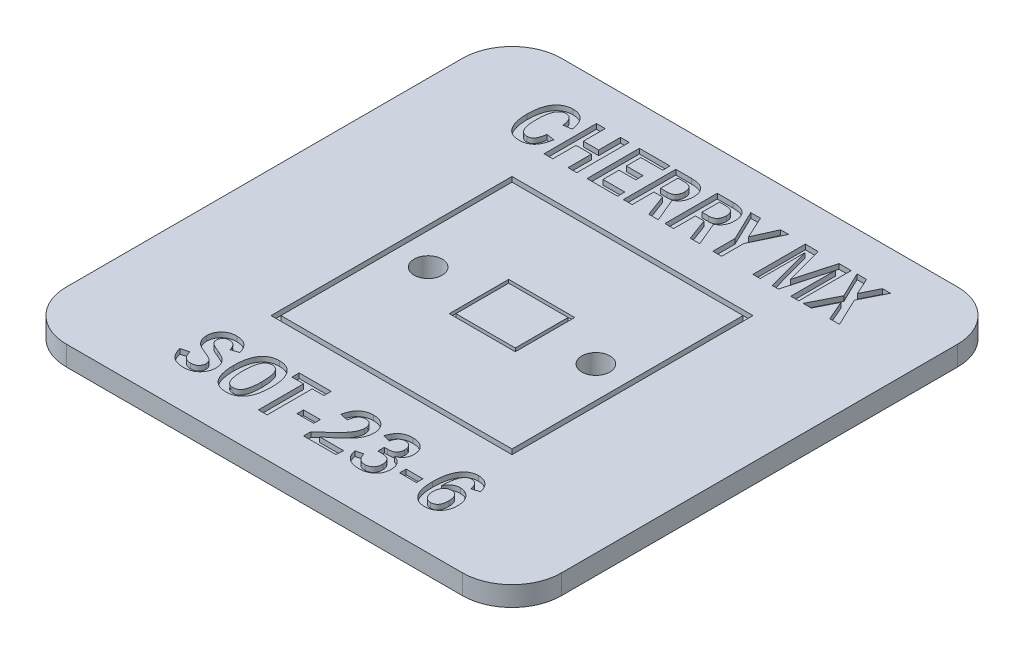
from build123d import *

# Parameters (mm, degrees)
SKETCH1_W               = 30
SKETCH1_H               = 30
BOSS_EXTRUDE1_DEPTH     = 1.2
SKETCH2_R               = 0.85
CUT_EXTRUDE1_DEPTH      = 22.247117452
SKETCH7_W               = 14.6
SKETCH7_H               = 14.6
SKETCH7_W_2             = 14
SKETCH7_H_2             = 14
CUT_EXTRUDE_THIN1_DEPTH = 0.3
SKETCH8_W               = 1.014236111
SKETCH8_H               = 0.396875
SKETCH8_W_2             = 1.014236112
CUT_EXTRUDE2_DEPTH      = 0.3
SKETCH9_W               = 4
SKETCH9_H               = 3.6
SKETCH9_W_2             = 3.6
SKETCH9_H_2             = 3.2
CUT_EXTRUDE_THIN2_DEPTH = 0.2
FILLET1_R               = 3


with BuildPart() as part:
    # Sketch1 → Boss-Extrude1 (new body)
    with BuildSketch(Plane(origin=(0, 0, 0), x_dir=(1, 0, 0), z_dir=(0, 1, 0))):
        Rectangle(SKETCH1_W, SKETCH1_H)
    extrude(amount=-BOSS_EXTRUDE1_DEPTH)

    # Sketch2 → Cut-Extrude1 (cut, through all)
    with BuildSketch(Plane(origin=(0, 0, 0), x_dir=(1, 0, 0), z_dir=(0, 1, 0))):
        with Locations(Location((-5.08, 0, 0), (0, 0, 270))):
            Circle(SKETCH2_R)
        with Locations(Location((5.08, 0, 0), (0, 0, 270))):
            Circle(SKETCH2_R)
    extrude(amount=-CUT_EXTRUDE1_DEPTH, mode=Mode.SUBTRACT)

    # Sketch7 → Cut-Extrude-Thin1 (cut)
    with BuildSketch(Plane(origin=(0, 0, 0), x_dir=(1, 0, 0), z_dir=(0, 1, 0))):
        Rectangle(SKETCH7_W, SKETCH7_H)
        Rectangle(SKETCH7_W_2, SKETCH7_H_2, mode=Mode.SUBTRACT)
    extrude(amount=-CUT_EXTRUDE_THIN1_DEPTH, mode=Mode.SUBTRACT)

    # Sketch8 → Cut-Extrude2 (cut)
    # profile 1 of 16: a face of its own
    with BuildSketch(Plane(origin=(0, 0, 0), x_dir=(1, 0, 0), z_dir=(0, 1, 0))):
        with BuildLine():
            Line((-6.305902778, -10.180242122), (-6.746875, -10.336649457))
            add(Edge.make_bspline(
                [(-6.746875, -10.336649457), (-6.759467834, -10.297802865), (-6.783348662, -10.224134874), (-6.828490901, -10.123364689), (-6.880369225, -10.039020337), (-6.937786584, -9.969131039), (-7.005455697, -9.915465301), (-7.083908539, -9.877650969), (-7.173574612, -9.855653747), (-7.236871996, -9.852975158), (-7.269840495, -9.851580012)],
                knots=[0, 0, 0, 0, 1.26087149, 2.391094449, 3.401030277, 4.312116731, 5.170791245, 6.046499601, 6.982517599, 8, 8, 8, 8], degree=3))
            add(Edge.make_bspline(
                [(-7.269840495, -9.851580012), (-7.300310709, -9.852921733), (-7.358462009, -9.855482359), (-7.440524245, -9.878012499), (-7.512070275, -9.915399533), (-7.569920187, -9.968832053), (-7.614785933, -10.030942091), (-7.648922552, -10.097645601), (-7.668796609, -10.169709002), (-7.67152773, -10.219168046), (-7.672916667, -10.244320898)],
                knots=[0, 0, 0, 0, 1.158393549, 2.210752077, 3.212357583, 4.203022126, 5.179064659, 6.11771898, 7.042748671, 8, 8, 8, 8], degree=3))
            add(Edge.make_bspline(
                [(-7.672916667, -10.244320898), (-7.671576988, -10.271364753), (-7.668982587, -10.323737463), (-7.645525759, -10.397928515), (-7.606483536, -10.463130205), (-7.561344713, -10.50967602), (-7.515957948, -10.543164177), (-7.474356275, -10.570371592), (-7.424864644, -10.598825275), (-7.36765403, -10.627815584), (-7.303777283, -10.659987902), (-7.231796355, -10.691984375), (-7.152591263, -10.725853187), (-7.096945705, -10.748111837), (-7.067957899, -10.759707182)],
                knots=[0, 0, 0, 0, 1.142383893, 2.212322889, 3.254295603, 4.333687511, 4.930565972, 5.639673117, 6.43668443, 7.345385944, 8.353993573, 9.463434283, 10.678610166, 12, 12, 12, 12], degree=3))
            add(Edge.make_bspline(
                [(-7.067957899, -10.759707182), (-7.019045569, -10.779174059), (-6.926587947, -10.815971755), (-6.799022166, -10.87589415), (-6.688127707, -10.932235043), (-6.593270116, -10.989706021), (-6.510703778, -11.05080341), (-6.438059801, -11.120394182), (-6.374907975, -11.200482197), (-6.318783212, -11.288448028), (-6.272994871, -11.384932494), (-6.240523884, -11.48973176), (-6.220916988, -11.601868222), (-6.218794349, -11.679237141), (-6.217708333, -11.718821766)],
                knots=[0, 0, 0, 0, 1.37004768, 2.589763122, 3.667395023, 4.60663127, 5.473533797, 6.336116821, 7.216601962, 8.122222573, 9.047579795, 9.987367701, 10.970267445, 12, 12, 12, 12], degree=3))
            add(Edge.make_bspline(
                [(-6.217708333, -11.718821766), (-6.218436446, -11.751248139), (-6.21987303, -11.815226208), (-6.233271394, -11.90945239), (-6.255615308, -11.999684218), (-6.284876267, -12.086940577), (-6.324873361, -12.169630733), (-6.372232435, -12.249422746), (-6.429488982, -12.32460231), (-6.493788242, -12.39606777), (-6.565781644, -12.461955239), (-6.646374713, -12.518188665), (-6.732912448, -12.566991634), (-6.826775592, -12.606454359), (-6.927849643, -12.636414601), (-7.03548258, -12.658400204), (-7.150073078, -12.671767592), (-7.22869193, -12.673110919), (-7.269151476, -12.673802234)],
                knots=[0, 0, 0, 0, 0.974796587, 1.923298778, 2.854746941, 3.7678046, 4.68542295, 5.611760636, 6.553903743, 7.522193674, 8.500239551, 9.481451027, 10.47101442, 11.483196193, 12.536447957, 13.636407375, 14.783626568, 16, 16, 16, 16], degree=3))
            add(Edge.make_bspline(
                [(-7.269151476, -12.673802234), (-7.304088828, -12.673172085), (-7.37251432, -12.671937925), (-7.472700257, -12.6613515), (-7.567908886, -12.644414819), (-7.658035104, -12.620177369), (-7.743023104, -12.589339216), (-7.822780635, -12.551121939), (-7.897506577, -12.506402064), (-7.966778772, -12.454200536), (-8.031164915, -12.395590047), (-8.089886856, -12.329514153), (-8.143975884, -12.256745001), (-8.1926529, -12.176850536), (-8.236124005, -12.090087592), (-8.274776048, -11.996906445), (-8.307870525, -11.896641529), (-8.325398479, -11.826890227), (-8.334375, -11.791168771)],
                knots=[0, 0, 0, 0, 1.105195373, 2.1645469, 3.183728959, 4.162091096, 5.113885907, 6.040261944, 6.956290289, 7.864676729, 8.780272584, 9.706648621, 10.657194193, 11.645545357, 12.662782435, 13.724897135, 14.834860619, 16, 16, 16, 16], degree=3))
            Line((-8.334375, -11.791168771), (-7.849305556, -11.659566123))
            add(Edge.make_bspline(
                [(-7.849305556, -11.659566123), (-7.844361034, -11.682847682), (-7.834734723, -11.728173713), (-7.815011567, -11.793137064), (-7.793218217, -11.853751783), (-7.768437484, -11.910116794), (-7.740121585, -11.961480231), (-7.709731006, -12.009022909), (-7.676090543, -12.052016779), (-7.638475777, -12.089607118), (-7.599274618, -12.124174707), (-7.556072038, -12.152822619), (-7.510483836, -12.17820278), (-7.461412654, -12.197626148), (-7.409977659, -12.214077201), (-7.355157313, -12.22462403), (-7.297596865, -12.23187972), (-7.258151034, -12.232510238), (-7.238145616, -12.232830012)],
                knots=[0, 0, 0, 0, 1.238522259, 2.411234589, 3.530812253, 4.590632793, 5.612616069, 6.581018509, 7.525884411, 8.447465876, 9.346193683, 10.241574854, 11.140461714, 12.057455654, 12.983987734, 13.947728852, 14.959166515, 16, 16, 16, 16], degree=3))
            add(Edge.make_bspline(
                [(-7.238145616, -12.232830012), (-7.218599566, -12.232494116), (-7.180781057, -12.231844211), (-7.125820964, -12.225088464), (-7.074143663, -12.216243391), (-7.026542975, -12.201400093), (-6.982399057, -12.183372298), (-6.941715455, -12.161561902), (-6.904771101, -12.13502596), (-6.861282218, -12.094781424), (-6.815055798, -12.038052456), (-6.775240031, -11.960879396), (-6.750632083, -11.876027913), (-6.748152219, -11.81683309), (-6.746875, -11.786345637)],
                knots=[0, 0, 0, 0, 0.938995443, 1.816807371, 2.659119456, 3.455387719, 4.207819431, 4.94882527, 5.668807742, 6.387688999, 7.792911655, 9.160685439, 10.537651384, 12, 12, 12, 12], degree=3))
            add(Edge.make_bspline(
                [(-6.746875, -11.786345637), (-6.747939533, -11.763514733), (-6.750064653, -11.717937553), (-6.767127305, -11.651185172), (-6.795646719, -11.587613749), (-6.827245447, -11.536231505), (-6.862254624, -11.496805116), (-6.896765864, -11.466215125), (-6.939260757, -11.434806219), (-6.990741759, -11.404661742), (-7.049216568, -11.371581989), (-7.116897469, -11.34002709), (-7.192111251, -11.306615191), (-7.245412994, -11.285464557), (-7.27328559, -11.274404448)],
                knots=[0, 0, 0, 0, 1.041379233, 2.078898261, 3.121121657, 4.214762738, 4.816429796, 5.521722936, 6.316496071, 7.224567373, 8.242943721, 9.382512311, 10.631260979, 12, 12, 12, 12], degree=3))
            add(Edge.make_bspline(
                [(-7.27328559, -11.274404448), (-7.303179337, -11.262782443), (-7.360820303, -11.240372955), (-7.443679766, -11.206456971), (-7.520181017, -11.174105063), (-7.590345778, -11.143324303), (-7.65392864, -11.113578747), (-7.711168494, -11.085392899), (-7.762056386, -11.058714286), (-7.821442028, -11.024891267), (-7.888406552, -10.976996124), (-7.962312908, -10.909718279), (-8.029017748, -10.829577419), (-8.089287554, -10.739430316), (-8.140115275, -10.639990713), (-8.175573338, -10.531910102), (-8.198713765, -10.417560366), (-8.200946638, -10.338831947), (-8.202083333, -10.298753406)],
                knots=[0, 0, 0, 0, 1.057021987, 2.038144284, 2.950550819, 3.794417178, 4.563101616, 5.263824, 5.896981152, 6.456546308, 7.515084904, 8.602669439, 9.741440011, 10.942265597, 12.171058942, 13.408563865, 14.680768927, 16, 16, 16, 16], degree=3))
            add(Edge.make_bspline(
                [(-8.202083333, -10.298753406), (-8.201263933, -10.267939651), (-8.199655739, -10.20746312), (-8.187721078, -10.118598449), (-8.167951301, -10.033559663), (-8.139262548, -9.952471832), (-8.103393191, -9.874752486), (-8.059164249, -9.800752894), (-8.006395555, -9.731085668), (-7.946574207, -9.66562667), (-7.880103721, -9.606086172), (-7.80818255, -9.55315632), (-7.730486307, -9.508801266), (-7.647329757, -9.473188583), (-7.559319867, -9.444559738), (-7.465792763, -9.424796305), (-7.367063859, -9.413045737), (-7.299500927, -9.411431621), (-7.265017361, -9.41060779)],
                knots=[0, 0, 0, 0, 1.021228651, 2.004311557, 2.966445923, 3.910333354, 4.85046725, 5.799712937, 6.762058142, 7.742809261, 8.734843209, 9.715535223, 10.697644764, 11.693353032, 12.70940338, 13.760670458, 14.857064595, 16, 16, 16, 16], degree=3))
            add(Edge.make_bspline(
                [(-7.265017361, -9.41060779), (-7.234447549, -9.41106167), (-7.174547744, -9.411951023), (-7.086788068, -9.421139105), (-7.00309976, -9.436077203), (-6.923703426, -9.45766938), (-6.848314694, -9.484215758), (-6.777471208, -9.517517939), (-6.711218396, -9.557319558), (-6.648150371, -9.601500201), (-6.590684917, -9.653551844), (-6.536725387, -9.710713349), (-6.487188549, -9.774177949), (-6.442199021, -9.843668504), (-6.401525671, -9.919053121), (-6.365100786, -10.000633882), (-6.33264151, -10.088108381), (-6.314936722, -10.14911383), (-6.305902778, -10.180242122)],
                knots=[0, 0, 0, 0, 1.094141776, 2.143908473, 3.155192916, 4.134582797, 5.086524694, 6.013491617, 6.931553119, 7.85112323, 8.765494759, 9.702076839, 10.662715678, 11.643450899, 12.662627666, 13.726311454, 14.839840677, 16, 16, 16, 16], degree=3))
        make_face()
    # profile 2 of 16: a face of its own
    with BuildSketch(Plane(origin=(0, 0, 0), x_dir=(1, 0, 0), z_dir=(0, 1, 0))):
        with BuildLine():
            add(Edge.make_bspline(
                [(-3.527777778, -11.040826974), (-3.528808867, -11.106069223), (-3.530807861, -11.232555736), (-3.543172435, -11.416282028), (-3.56719161, -11.587526521), (-3.597700782, -11.746982958), (-3.639770664, -11.893638968), (-3.688139556, -12.0289202), (-3.74906216, -12.150621986), (-3.816661208, -12.261101079), (-3.894554743, -12.358184149), (-3.980223672, -12.443059528), (-4.074709177, -12.514737507), (-4.177756023, -12.572906766), (-4.288762559, -12.618787318), (-4.408237435, -12.650920821), (-4.535842839, -12.670651272), (-4.623703762, -12.672733598), (-4.668793403, -12.673802234)],
                knots=[0, 0, 0, 0, 1.387405284, 2.689791638, 3.912290092, 5.062586086, 6.138607472, 7.153780875, 8.112601016, 9.027336013, 9.90293063, 10.752477972, 11.585654305, 12.41675262, 13.262021801, 14.132822719, 15.041777053, 16, 16, 16, 16], degree=3))
            add(Edge.make_bspline(
                [(-4.668793403, -12.673802234), (-4.714112059, -12.672742885), (-4.802201479, -12.670683746), (-4.930272511, -12.650897536), (-5.050010091, -12.618589701), (-5.162061535, -12.573798939), (-5.265680236, -12.515192738), (-5.361218404, -12.444030367), (-5.448052869, -12.359373042), (-5.527051211, -12.262522434), (-5.596264145, -12.152255029), (-5.657444888, -12.030144405), (-5.707910713, -11.895343549), (-5.749172036, -11.748222992), (-5.781149088, -11.588800048), (-5.804378488, -11.417139863), (-5.818107988, -11.233057738), (-5.819904983, -11.106307679), (-5.820833333, -11.040826974)],
                knots=[0, 0, 0, 0, 0.959958664, 1.865946784, 2.738602594, 3.583781031, 4.416404134, 5.254643166, 6.101502103, 6.980354043, 7.897287051, 8.855145282, 9.870419088, 10.942929064, 12.090431879, 13.313763798, 14.612255936, 16, 16, 16, 16], degree=3))
            add(Edge.make_bspline(
                [(-5.820833333, -11.040826974), (-5.819918078, -10.976032258), (-5.818140562, -10.850194529), (-5.804155182, -10.667560521), (-5.782092868, -10.496910741), (-5.749629285, -10.338528671), (-5.708657098, -10.192113139), (-5.658491499, -10.057440793), (-5.598579371, -9.935041679), (-5.529566341, -9.824642186), (-5.451541403, -9.726923988), (-5.364909299, -9.642002617), (-5.269428765, -9.570299598), (-5.165816161, -9.511385267), (-5.053456641, -9.466476725), (-4.933218621, -9.434246485), (-4.804781482, -9.413588488), (-4.71618714, -9.411616632), (-4.67086046, -9.41060779)],
                knots=[0, 0, 0, 0, 1.375616577, 2.671583047, 3.886798661, 5.026811174, 6.101251535, 7.112067152, 8.073852531, 8.989830394, 9.87099314, 10.722775264, 11.55862007, 12.3993867, 13.246086354, 14.120312836, 15.038313529, 16, 16, 16, 16], degree=3))
            add(Edge.make_bspline(
                [(-4.67086046, -9.41060779), (-4.626002291, -9.411678494), (-4.538601826, -9.413764624), (-4.411430323, -9.433495267), (-4.292420372, -9.465877807), (-4.180790448, -9.510455041), (-4.078622448, -9.569945976), (-3.98338746, -9.640502583), (-3.89801595, -9.725779317), (-3.819679295, -9.822482363), (-3.750705825, -9.932273389), (-3.690816688, -10.054295998), (-3.639776773, -10.188515703), (-3.598946517, -10.335315131), (-3.566519486, -10.494156841), (-3.54445861, -10.665496295), (-3.530453123, -10.849046296), (-3.528688076, -10.975572773), (-3.527777778, -11.040826974)],
                knots=[0, 0, 0, 0, 0.954287532, 1.859308474, 2.730970896, 3.575224249, 4.409568651, 5.240626948, 6.091014766, 6.970537783, 7.884636552, 8.844405276, 9.859441762, 10.93652768, 12.084136384, 13.307189876, 14.611222124, 16, 16, 16, 16], degree=3))
        make_face()
        with BuildLine():
            add(Edge.make_bspline(
                [(-4.101041667, -11.042205012), (-4.101399112, -10.997180642), (-4.1020943, -10.909613503), (-4.108593225, -10.782091167), (-4.117991747, -10.661871696), (-4.131230157, -10.549089774), (-4.150354869, -10.443705819), (-4.171946845, -10.345652707), (-4.197295376, -10.25455642), (-4.227196771, -10.171407334), (-4.262012418, -10.096467431), (-4.302691443, -10.030760485), (-4.349733838, -9.975161449), (-4.402808462, -9.929060743), (-4.462968778, -9.89460936), (-4.528725087, -9.869564769), (-4.600315647, -9.853967335), (-4.650108934, -9.852390104), (-4.675683594, -9.851580012)],
                knots=[0, 0, 0, 0, 1.466338751, 2.851857527, 4.157661103, 5.393542737, 6.548369209, 7.644528668, 8.662803672, 9.625923542, 10.519359159, 11.349553645, 12.134964639, 12.883046436, 13.627190835, 14.380156138, 15.16802127, 16, 16, 16, 16], degree=3))
            add(Edge.make_bspline(
                [(-4.675683594, -9.851580012), (-4.701260226, -9.852390408), (-4.751057354, -9.85396823), (-4.822410136, -9.869515594), (-4.888000632, -9.894424424), (-4.947113693, -9.930299809), (-5.000996721, -9.975507631), (-5.047886844, -10.031534966), (-5.088967094, -10.097123042), (-5.122572306, -10.172700612), (-5.152042695, -10.256235495), (-5.177108736, -10.347317661), (-5.19927603, -10.445209651), (-5.217099805, -10.550557985), (-5.230705006, -10.663234728), (-5.239966827, -10.783245224), (-5.246528411, -10.910300641), (-5.247215905, -10.99740976), (-5.247569444, -11.042205012)],
                knots=[0, 0, 0, 0, 0.832976012, 1.621785547, 2.368664186, 3.111060873, 3.865746753, 4.652099208, 5.483288837, 6.38142501, 7.34316566, 8.369870719, 9.460036704, 10.61496114, 11.852324209, 13.159693035, 14.539392097, 16, 16, 16, 16], degree=3))
            add(Edge.make_bspline(
                [(-5.247569444, -11.042205012), (-5.247130385, -11.086307655), (-5.246274784, -11.172251189), (-5.240863686, -11.297738924), (-5.231427986, -11.416365646), (-5.21742879, -11.528249369), (-5.200710125, -11.633438798), (-5.179295373, -11.731897471), (-5.153835971, -11.823165258), (-5.125572894, -11.907750024), (-5.091379287, -11.983830366), (-5.051169663, -12.050895313), (-5.002741084, -12.106790231), (-4.948446064, -12.152968205), (-4.887797098, -12.189384812), (-4.820433389, -12.215039863), (-4.746661364, -12.230439581), (-4.69528232, -12.232016842), (-4.668793403, -12.232830012)],
                knots=[0, 0, 0, 0, 1.431345973, 2.789287046, 4.07561803, 5.292336487, 6.447925522, 7.5313253, 8.560357691, 9.522128114, 10.422800425, 11.262726267, 12.050210629, 12.81183465, 13.567342581, 14.33423742, 15.141201474, 16, 16, 16, 16], degree=3))
            add(Edge.make_bspline(
                [(-4.668793403, -12.232830012), (-4.643920827, -12.231932039), (-4.595340066, -12.230178131), (-4.52519491, -12.215685469), (-4.460907773, -12.190697627), (-4.402755076, -12.155341969), (-4.349871141, -12.111031956), (-4.303473534, -12.056203203), (-4.262467313, -11.992024591), (-4.228051639, -11.917992025), (-4.197856572, -11.835589615), (-4.1719529, -11.74526411), (-4.149871991, -11.647026464), (-4.132501468, -11.540901813), (-4.117592537, -11.427211526), (-4.108708586, -11.305747262), (-4.102052619, -11.176637559), (-4.101385448, -11.087919805), (-4.101041667, -11.042205012)],
                knots=[0, 0, 0, 0, 0.812502347, 1.586968033, 2.328646143, 3.056091242, 3.802012743, 4.573963627, 5.394473157, 6.284347561, 7.236843263, 8.260856074, 9.353643111, 10.52614691, 11.774863089, 13.100342196, 14.505854215, 16, 16, 16, 16], degree=3))
        make_face(mode=Mode.SUBTRACT)
    # profile 3 of 16: a face of its own
    with BuildSketch(Plane(origin=(0, 0, 0), x_dir=(1, 0, 0), z_dir=(0, 1, 0))):
        Polygon((-3.439583333, -9.454705012), (-1.499305556, -9.454705012), (-1.499305556, -9.895677234), (-2.204861111, -9.895677234), (-2.204861111, -12.629705012), (-2.734027778, -12.629705012), (-2.734027778, -9.895677234), (-3.439583333, -9.895677234), align=None)
    # profile 4 of 16: a face of its own
    with BuildSketch(Plane(origin=(0, 0, 0), x_dir=(1, 0, 0), z_dir=(0, 1, 0))):
        with Locations((-0.859895834, -11.461128623)):
            Rectangle(SKETCH8_W, SKETCH8_H)
    # profile 5 of 16: a face of its own
    with BuildSketch(Plane(origin=(0, 0, 0), x_dir=(1, 0, 0), z_dir=(0, 1, 0))):
        with BuildLine():
            Line((0.485069444, -10.468941123), (0, -10.370411392))
            add(Edge.make_bspline(
                [(0, -10.370411392), (0.007603578, -10.332188397), (0.022404666, -10.257783696), (0.051340998, -10.150368278), (0.086298158, -10.050044447), (0.128003486, -9.95708327), (0.173662226, -9.870265958), (0.226524023, -9.791437789), (0.284535375, -9.719407664), (0.3479596, -9.654246428), (0.417094439, -9.597198058), (0.490506402, -9.547038239), (0.568668051, -9.505054253), (0.651217056, -9.470291322), (0.738488885, -9.44348383), (0.830240936, -9.424126079), (0.926698264, -9.413229396), (0.992390666, -9.411494206), (1.025949436, -9.41060779)],
                knots=[0, 0, 0, 0, 1.208990959, 2.353416033, 3.448797058, 4.501600363, 5.512293545, 6.488688184, 7.441389338, 8.378720737, 9.304851011, 10.218031639, 11.133156684, 12.053014379, 12.992969883, 13.961557313, 14.95866757, 16, 16, 16, 16], degree=3))
            add(Edge.make_bspline(
                [(1.025949436, -9.41060779), (1.062272623, -9.411371346), (1.13330223, -9.412864473), (1.23686239, -9.425389588), (1.334331721, -9.446131165), (1.426068848, -9.473996712), (1.511289141, -9.511457663), (1.590193814, -9.557457885), (1.664103738, -9.610442899), (1.730411051, -9.67273404), (1.790091154, -9.740620277), (1.842717071, -9.813441466), (1.885312009, -9.891795952), (1.923136568, -9.973401581), (1.949884021, -10.060725245), (1.970253081, -10.152127245), (1.981916959, -10.248384748), (1.983544115, -10.314111352), (1.984375, -10.347673762)],
                knots=[0, 0, 0, 0, 1.153049117, 2.254775329, 3.30603747, 4.314016098, 5.293632947, 6.254255045, 7.209686878, 8.174645019, 9.135765235, 10.076755048, 11.020228284, 11.963560592, 12.927608954, 13.91317933, 14.934392954, 16, 16, 16, 16], degree=3))
            add(Edge.make_bspline(
                [(1.984375, -10.347673762), (1.983044223, -10.387000669), (1.980378071, -10.465790381), (1.963049216, -10.583229271), (1.9327337, -10.69879737), (1.892199872, -10.813265322), (1.838555147, -10.925816313), (1.773316147, -11.036799931), (1.69736817, -11.147079932), (1.60826436, -11.254841026), (1.508889971, -11.363576987), (1.399133657, -11.473985648), (1.280014553, -11.588135039), (1.149653743, -11.70336265), (1.009219819, -11.821311812), (0.85926664, -11.942805632), (0.698107349, -12.065738748), (0.586285049, -12.147148841), (0.529166667, -12.18873279)],
                knots=[0, 0, 0, 0, 0.775754143, 1.554188977, 2.335426668, 3.12927755, 3.945964518, 4.790559411, 5.666455862, 6.584141519, 7.546209919, 8.57132063, 9.65437591, 10.799969579, 12.002421741, 13.271715478, 14.606403203, 16, 16, 16, 16], degree=3))
            Line((0.529166667, -12.18873279), (1.984375, -12.18873279))
            Line((1.984375, -12.18873279), (1.960948351, -12.629705012))
            Line((1.960948351, -12.629705012), (0, -12.629705012))
            Line((0, -12.629705012), (0, -12.192866904))
            add(Edge.make_bspline(
                [(0, -12.192866904), (0.038143845, -12.160274585), (0.112935431, -12.096368303), (0.222440628, -12.002178601), (0.326469747, -11.911208234), (0.425079251, -11.823783651), (0.518053648, -11.739420101), (0.606610126, -11.65920549), (0.688701023, -11.580927033), (0.76720758, -11.507884653), (0.838289457, -11.436306266), (0.90576397, -11.36986531), (0.966794054, -11.305490794), (1.023413811, -11.24516893), (1.07441673, -11.187964116), (1.120031433, -11.134299262), (1.160030317, -11.083813076), (1.206417641, -11.022345166), (1.256277116, -10.94773527), (1.309754782, -10.860805762), (1.35413757, -10.775263889), (1.39086892, -10.692290285), (1.419095373, -10.611332432), (1.440623038, -10.533019449), (1.452418576, -10.456441497), (1.454293008, -10.406045248), (1.455208333, -10.381435698)],
                knots=[0, 0, 0, 0, 1.516678391, 2.973868579, 4.366356088, 5.694219057, 6.957547615, 8.161561954, 9.305967908, 10.386437177, 11.402694521, 12.355117827, 13.248844122, 14.083961521, 14.856002481, 15.565406314, 16.212739872, 16.802889595, 17.892820286, 18.923980975, 19.886648798, 20.803800122, 21.664556433, 22.476286539, 23.255938589, 24, 24, 24, 24], degree=3))
            add(Edge.make_bspline(
                [(1.455208333, -10.381435698), (1.453869929, -10.344335663), (1.451290093, -10.272823652), (1.428288736, -10.170847925), (1.389869256, -10.079347082), (1.345414702, -10.01194254), (1.303241394, -9.965211278), (1.269236838, -9.934147098), (1.231896323, -9.908876354), (1.191940082, -9.887788516), (1.149393201, -9.871365809), (1.104104488, -9.859586576), (1.056260417, -9.852545758), (1.023447321, -9.85190691), (1.006656901, -9.851580012)],
                knots=[0, 0, 0, 0, 1.710231617, 3.296549565, 4.792499051, 6.268037961, 6.995902736, 7.693833713, 8.387568028, 9.070204489, 9.774782197, 10.486812605, 11.225703942, 12, 12, 12, 12], degree=3))
            add(Edge.make_bspline(
                [(1.006656901, -9.851580012), (0.988703616, -9.851804717), (0.953770766, -9.852241939), (0.902919415, -9.860661415), (0.854357787, -9.871681805), (0.809055734, -9.889291759), (0.766046514, -9.910767619), (0.726505016, -9.937710582), (0.689146235, -9.968995826), (0.655885086, -10.006078412), (0.623437626, -10.046569313), (0.5958207, -10.093137486), (0.569832276, -10.143827606), (0.547577261, -10.199566901), (0.527304721, -10.260006135), (0.510491385, -10.325232187), (0.495721502, -10.395322613), (0.48869862, -10.443859163), (0.485069444, -10.468941123)],
                knots=[0, 0, 0, 0, 0.960263485, 1.868445876, 2.754615096, 3.622841714, 4.464606068, 5.32442521, 6.179744268, 7.06770485, 7.988053711, 8.954365789, 9.961175504, 11.037158835, 12.165324358, 13.373801617, 14.642874175, 16, 16, 16, 16], degree=3))
        make_face()
    # profile 6 of 16: a face of its own
    with BuildSketch(Plane(origin=(0, 0, 0), x_dir=(1, 0, 0), z_dir=(0, 1, 0))):
        with BuildLine():
            Line((2.866319444, -10.292552234), (2.425347222, -10.18919937))
            add(Edge.make_bspline(
                [(2.425347222, -10.18919937), (2.43453625, -10.157584711), (2.452514471, -10.09573102), (2.486605505, -10.007472692), (2.524532235, -9.925409058), (2.565827362, -9.848826078), (2.612063547, -9.778637225), (2.662121148, -9.714157506), (2.717476957, -9.656735165), (2.775546457, -9.604045103), (2.838894046, -9.558138478), (2.906693708, -9.519319866), (2.977880854, -9.4846577), (3.054023419, -9.458575166), (3.133758514, -9.436577454), (3.218006431, -9.422085794), (3.306344204, -9.411702065), (3.366744457, -9.410977416), (3.397553168, -9.41060779)],
                knots=[0, 0, 0, 0, 1.164944352, 2.279199313, 3.344976403, 4.363635347, 5.35576875, 6.316941599, 7.248502688, 8.175476267, 9.08938109, 10.011063354, 10.938357728, 11.887176947, 12.855474768, 13.863305628, 14.910123768, 16, 16, 16, 16], degree=3))
            add(Edge.make_bspline(
                [(3.397553168, -9.41060779), (3.432715704, -9.411252425), (3.501133699, -9.412506732), (3.600756241, -9.422702103), (3.694464349, -9.440898223), (3.78252508, -9.465155615), (3.864725108, -9.497437455), (3.941583412, -9.535625908), (4.012157665, -9.582144082), (4.076391909, -9.635497175), (4.134293198, -9.694316627), (4.184282216, -9.759327501), (4.227304755, -9.828827608), (4.261745213, -9.903942764), (4.288778905, -9.983824581), (4.308136846, -10.068985304), (4.318895989, -10.159525345), (4.320637284, -10.221555893), (4.321527778, -10.253278146)],
                knots=[0, 0, 0, 0, 1.191820192, 2.319000844, 3.389360958, 4.42457143, 5.410600476, 6.378544248, 7.3286646, 8.268683313, 9.204630844, 10.120315031, 11.042989276, 11.969564078, 12.914983764, 13.897101508, 14.92458346, 16, 16, 16, 16], degree=3))
            add(Edge.make_bspline(
                [(4.321527778, -10.253278146), (4.320240525, -10.293141958), (4.31773862, -10.370621301), (4.29346908, -10.482107569), (4.255103109, -10.584714111), (4.200084537, -10.677753066), (4.130622905, -10.762294723), (4.044238136, -10.836092961), (3.943372711, -10.901867161), (3.86800186, -10.935739459), (3.828879123, -10.953321549)],
                knots=[0, 0, 0, 0, 1.044489364, 2.030070488, 2.977889712, 3.906906964, 4.85273231, 5.835029569, 6.876229085, 8, 8, 8, 8], degree=3))
            add(Edge.make_bspline(
                [(3.828879123, -10.953321549), (3.85242879, -10.960069071), (3.898705632, -10.973328453), (3.964342678, -10.999044873), (4.026015862, -11.027409549), (4.082924007, -11.059687641), (4.135834365, -11.095450863), (4.183141084, -11.135648831), (4.226622987, -11.178660718), (4.264989196, -11.225786901), (4.299907689, -11.275825644), (4.328603355, -11.330612546), (4.354399829, -11.387845746), (4.374226885, -11.449433728), (4.389980307, -11.514161605), (4.40174525, -11.582503896), (4.408762174, -11.654594436), (4.409396723, -11.703876979), (4.409722222, -11.729157052)],
                knots=[0, 0, 0, 0, 1.112507791, 2.186160371, 3.199276012, 4.194661506, 5.155645749, 6.096300007, 7.011308296, 7.930591238, 8.853952153, 9.77843283, 10.736295605, 11.703211035, 12.713096756, 13.76134447, 14.851654744, 16, 16, 16, 16], degree=3))
            add(Edge.make_bspline(
                [(4.409722222, -11.729157052), (4.408698595, -11.76478935), (4.406697094, -11.834461269), (4.393927051, -11.936163514), (4.370718084, -12.03176447), (4.340057141, -12.122190982), (4.299163635, -12.206549422), (4.24920524, -12.284731179), (4.190800382, -12.357366501), (4.123254683, -12.422902771), (4.049192545, -12.482050525), (3.969342071, -12.533127468), (3.884942831, -12.577159757), (3.794555826, -12.611829891), (3.699649432, -12.640693674), (3.599095738, -12.659294978), (3.493856152, -12.671460537), (3.421934604, -12.673009849), (3.385150825, -12.673802234)],
                knots=[0, 0, 0, 0, 1.088980448, 2.12928616, 3.125150545, 4.090676379, 5.041809753, 5.982213758, 6.920493916, 7.883337551, 8.852301017, 9.812095766, 10.775783182, 11.755892224, 12.766291959, 13.802778891, 14.876246426, 16, 16, 16, 16], degree=3))
            add(Edge.make_bspline(
                [(3.385150825, -12.673802234), (3.352049121, -12.673420129), (3.286845801, -12.672667463), (3.191160163, -12.662343935), (3.098970259, -12.647621321), (3.010886026, -12.625986764), (2.92620664, -12.599602517), (2.846161575, -12.56521799), (2.769279121, -12.525983727), (2.696140126, -12.480844766), (2.628113647, -12.428336924), (2.566699272, -12.368156944), (2.511519487, -12.30054257), (2.46368431, -12.225077655), (2.420981035, -12.142553676), (2.386596264, -12.051933351), (2.356962076, -11.954443122), (2.343874291, -11.886174334), (2.337152778, -11.851113432)],
                knots=[0, 0, 0, 0, 1.080184092, 2.127733048, 3.138570003, 4.126110581, 5.086518904, 6.030750025, 6.966397186, 7.902705135, 8.832625942, 9.765866289, 10.703914088, 11.675266261, 12.677977408, 13.732080883, 14.835261424, 16, 16, 16, 16], degree=3))
            Line((2.337152778, -11.851113432), (2.778125, -11.747760568))
            add(Edge.make_bspline(
                [(2.778125, -11.747760568), (2.788783828, -11.789430808), (2.809093153, -11.868829258), (2.85474778, -11.97769277), (2.91134428, -12.070339318), (2.979767573, -12.146468685), (3.059766903, -12.205471881), (3.150667088, -12.24737709), (3.2521944, -12.272647225), (3.323448741, -12.275467053), (3.360346137, -12.276927234)],
                knots=[0, 0, 0, 0, 1.195977426, 2.278814625, 3.272212759, 4.204492146, 5.109727702, 6.019219399, 6.974299022, 8, 8, 8, 8], degree=3))
            add(Edge.make_bspline(
                [(3.360346137, -12.276927234), (3.394538685, -12.27556759), (3.46169195, -12.272897286), (3.558040666, -12.244912926), (3.648198473, -12.203025804), (3.71496096, -12.152368882), (3.764052156, -12.10487115), (3.794738845, -12.061875555), (3.822130929, -12.015140923), (3.843128765, -11.962474808), (3.860712015, -11.905438593), (3.871665088, -11.842931402), (3.879891687, -11.775999216), (3.880329618, -11.72964535), (3.880555556, -11.705730403)],
                knots=[0, 0, 0, 0, 1.403616688, 2.756666251, 4.097009285, 5.475250154, 6.18377452, 6.900324905, 7.641336266, 8.408476545, 9.227883259, 10.093686127, 11.016492049, 12, 12, 12, 12], degree=3))
            add(Edge.make_bspline(
                [(3.880555556, -11.705730403), (3.880151167, -11.686655842), (3.879359643, -11.649320466), (3.873380076, -11.594570576), (3.861762803, -11.542719491), (3.84809119, -11.492946459), (3.828021735, -11.446455151), (3.80521087, -11.402030456), (3.776036065, -11.361562603), (3.744709017, -11.322036939), (3.706458968, -11.286585661), (3.661045679, -11.256192198), (3.608674477, -11.23051594), (3.548818652, -11.210231021), (3.482209199, -11.193823822), (3.408455869, -11.182269521), (3.327635811, -11.1753989), (3.271247518, -11.174805961), (3.241834852, -11.174496679)],
                knots=[0, 0, 0, 0, 0.959741695, 1.878539636, 2.764712316, 3.63138285, 4.470498175, 5.307940924, 6.138177319, 6.975620067, 7.842367634, 8.749390785, 9.715787803, 10.768300005, 11.92299372, 13.163540754, 14.520476094, 16, 16, 16, 16], degree=3))
            Line((3.241834852, -11.174496679), (3.042708333, -11.174496679))
            Line((3.042708333, -11.174496679), (3.042708333, -10.777621679))
            Line((3.042708333, -10.777621679), (3.234944661, -10.777621679))
            add(Edge.make_bspline(
                [(3.234944661, -10.777621679), (3.265956133, -10.777251965), (3.32391696, -10.776560965), (3.405279834, -10.770887967), (3.4747291, -10.759675131), (3.535078937, -10.746096701), (3.587827902, -10.723077413), (3.635331533, -10.690117533), (3.678030174, -10.646099091), (3.718177864, -10.594017046), (3.752287498, -10.53218206), (3.775159921, -10.460339836), (3.789926302, -10.380893472), (3.791529085, -10.325008138), (3.792361111, -10.29599733)],
                knots=[0, 0, 0, 0, 1.306812395, 2.442448627, 3.432085399, 4.270031385, 5.041399526, 5.841377409, 6.689930378, 7.615151135, 8.606867773, 9.647389581, 10.778729152, 12, 12, 12, 12], degree=3))
            add(Edge.make_bspline(
                [(3.792361111, -10.29599733), (3.791303294, -10.260490169), (3.789274456, -10.192389315), (3.766587305, -10.09617942), (3.730964955, -10.010820982), (3.680037478, -9.938393851), (3.616877533, -9.879229966), (3.540776066, -9.836959386), (3.453336559, -9.811657824), (3.391298056, -9.808913127), (3.358968099, -9.80748279)],
                knots=[0, 0, 0, 0, 1.152857373, 2.21111941, 3.194968125, 4.144173514, 5.069321866, 5.98574278, 6.950315603, 8, 8, 8, 8], degree=3))
            add(Edge.make_bspline(
                [(3.358968099, -9.80748279), (3.328729877, -9.808849599), (3.269864978, -9.811510374), (3.185851924, -9.834803018), (3.110258595, -9.873419587), (3.043751884, -9.928109324), (2.985206006, -9.997306542), (2.936748322, -10.082511016), (2.894825527, -10.181585034), (2.876135902, -10.254339168), (2.866319444, -10.292552234)],
                knots=[0, 0, 0, 0, 0.960201879, 1.869229839, 2.747968705, 3.641159501, 4.589481215, 5.614189305, 6.746887119, 8, 8, 8, 8], degree=3))
        make_face()
    # profile 7 of 16: a face of its own
    with BuildSketch(Plane(origin=(0, 0, 0), x_dir=(1, 0, 0), z_dir=(0, 1, 0))):
        with Locations((5.3578125, -11.461128623)):
            Rectangle(SKETCH8_W_2, SKETCH8_H)
    # profile 8 of 16: a face of its own
    with BuildSketch(Plane(origin=(0, 0, 0), x_dir=(1, 0, 0), z_dir=(0, 1, 0))):
        with BuildLine():
            Line((8.290277778, -10.19677858), (7.849305556, -10.336649457))
            add(Edge.make_bspline(
                [(7.849305556, -10.336649457), (7.839603845, -10.295065762), (7.82122903, -10.216307207), (7.78189028, -10.10802516), (7.735481727, -10.015588705), (7.680070304, -9.939536598), (7.61577651, -9.880180783), (7.543029714, -9.837655413), (7.461935397, -9.811879751), (7.405076821, -9.808972242), (7.375949436, -9.80748279)],
                knots=[0, 0, 0, 0, 1.320415538, 2.500836438, 3.556158449, 4.511387141, 5.396800876, 6.243993475, 7.100436859, 8, 8, 8, 8], degree=3))
            add(Edge.make_bspline(
                [(7.375949436, -9.80748279), (7.352449601, -9.808378557), (7.306362407, -9.810135309), (7.239750635, -9.824816656), (7.177983199, -9.849433738), (7.120625411, -9.883434186), (7.068969843, -9.928357851), (7.021345149, -9.982100395), (6.97974364, -10.046053314), (6.942331842, -10.119320322), (6.909423037, -10.202448775), (6.881070443, -10.295708034), (6.855181906, -10.398590657), (6.835228047, -10.511982972), (6.818104818, -10.635404042), (6.804118146, -10.769114105), (6.795656495, -10.913041505), (6.792566365, -11.012338869), (6.790972222, -11.063564604)],
                knots=[0, 0, 0, 0, 0.736961783, 1.445308047, 2.127955546, 2.81651418, 3.527203785, 4.267682298, 5.06336013, 5.914442228, 6.846053496, 7.865161061, 8.971795759, 10.173549944, 11.476334108, 12.882128839, 14.391546025, 16, 16, 16, 16], degree=3))
            add(Edge.make_bspline(
                [(6.790972222, -11.063564604), (6.808680476, -11.02700715), (6.842986385, -10.956184994), (6.907480776, -10.861437805), (6.979619249, -10.78035219), (7.061337521, -10.715311633), (7.150463372, -10.662794051), (7.248978209, -10.62773023), (7.354879921, -10.604435939), (7.42841254, -10.602320303), (7.466210937, -10.60123279)],
                knots=[0, 0, 0, 0, 1.11710447, 2.164148131, 3.144592981, 4.093621591, 5.028536282, 5.978828019, 6.961045293, 8, 8, 8, 8], degree=3))
            add(Edge.make_bspline(
                [(7.466210937, -10.60123279), (7.495892399, -10.601934075), (7.554406693, -10.603316594), (7.640257303, -10.61706872), (7.722847461, -10.63816982), (7.801943744, -10.668705681), (7.877375122, -10.708573153), (7.949877814, -10.755981729), (8.018605644, -10.812433982), (8.082834073, -10.876942261), (8.142184832, -10.94830847), (8.194147383, -11.026494966), (8.237549273, -11.110931737), (8.272951275, -11.201470334), (8.300066583, -11.297781393), (8.320379908, -11.400015304), (8.331908244, -11.508175811), (8.333540634, -11.582369384), (8.334375, -11.620292035)],
                knots=[0, 0, 0, 0, 0.949885732, 1.872613037, 2.777130627, 3.67594786, 4.580704677, 5.504867404, 6.445739512, 7.423551261, 8.416190002, 9.413776336, 10.423732754, 11.450899241, 12.5218767, 13.623975609, 14.785539787, 16, 16, 16, 16], degree=3))
            add(Edge.make_bspline(
                [(8.334375, -11.620292035), (8.333594827, -11.658906969), (8.332067421, -11.734506445), (8.319705037, -11.845234446), (8.298092821, -11.94996459), (8.26967762, -12.049273029), (8.231234183, -12.142083606), (8.185099635, -12.229629378), (8.129669036, -12.310832054), (8.067129845, -12.386061486), (7.997633992, -12.453548777), (7.922134591, -12.512535789), (7.841014254, -12.562441377), (7.754346389, -12.603308708), (7.662339771, -12.6348869), (7.565011868, -12.657959702), (7.462188796, -12.670756662), (7.391830373, -12.672773983), (7.355967882, -12.673802234)],
                knots=[0, 0, 0, 0, 1.14412879, 2.239950352, 3.295750621, 4.310111389, 5.295941155, 6.267191179, 7.237463022, 8.203860172, 9.161663317, 10.102412223, 11.037407259, 11.978156165, 12.93595931, 13.91490497, 14.937203256, 16, 16, 16, 16], degree=3))
            add(Edge.make_bspline(
                [(7.355967882, -12.673802234), (7.317778267, -12.672549765), (7.243068143, -12.670099567), (7.133597562, -12.652633926), (7.029917024, -12.623081726), (6.931731717, -12.581102298), (6.838670079, -12.527890368), (6.751813545, -12.461929618), (6.670437617, -12.3843759), (6.594467608, -12.295519261), (6.525857393, -12.193576762), (6.466774511, -12.078262523), (6.416228273, -11.950017685), (6.376472531, -11.808062134), (6.343873028, -11.65346228), (6.321644896, -11.48556015), (6.308792168, -11.304465154), (6.306888504, -11.179341568), (6.305902778, -11.114552017)],
                knots=[0, 0, 0, 0, 0.865592702, 1.693354019, 2.505826577, 3.303686096, 4.10838009, 4.930010549, 5.769737926, 6.652450014, 7.575238368, 8.548667082, 9.584198646, 10.694913213, 11.886626032, 13.163484106, 14.531239438, 16, 16, 16, 16], degree=3))
            add(Edge.make_bspline(
                [(6.305902778, -11.114552017), (6.306911299, -11.047698243), (6.308871429, -10.917763329), (6.321614146, -10.728858254), (6.344293616, -10.551933729), (6.375694979, -10.387079273), (6.415826777, -10.234091776), (6.46638619, -10.093924791), (6.524650065, -9.965191803), (6.592941932, -9.849523935), (6.668553925, -9.74618835), (6.751848053, -9.65679635), (6.840721726, -9.580028556), (6.93717645, -9.518175618), (7.039539934, -9.469211554), (7.148997534, -9.435890009), (7.264393347, -9.414246752), (7.343694272, -9.411838451), (7.384217665, -9.41060779)],
                knots=[0, 0, 0, 0, 1.42052953, 2.760896964, 4.020548075, 5.208306696, 6.324588463, 7.37736336, 8.370922975, 9.322548921, 10.226375386, 11.086179493, 11.913516785, 12.714884562, 13.513856392, 14.316486225, 15.139711298, 16, 16, 16, 16], degree=3))
            add(Edge.make_bspline(
                [(7.384217665, -9.41060779), (7.41111846, -9.41105235), (7.46415646, -9.41192885), (7.542200162, -9.421415274), (7.617671034, -9.435497039), (7.690162228, -9.456471733), (7.760332339, -9.482677903), (7.82764369, -9.515000514), (7.892358589, -9.553356941), (7.954333569, -9.597345919), (8.013206253, -9.647570311), (8.067381631, -9.705241569), (8.116017833, -9.770265473), (8.160498119, -9.841968584), (8.20034109, -9.92057939), (8.23539104, -10.006341119), (8.265731264, -10.098986427), (8.281948507, -10.16359516), (8.290277778, -10.19677858)],
                knots=[0, 0, 0, 0, 0.98425213, 1.940565916, 2.873836216, 3.791949006, 4.699219087, 5.613010232, 6.521409316, 7.449895725, 8.391910914, 9.349517342, 10.339926476, 11.359454946, 12.434826373, 13.562089892, 14.747875209, 16, 16, 16, 16], degree=3))
        make_face()
        with BuildLine():
            add(Edge.make_bspline(
                [(7.805208333, -11.632005359), (7.804769891, -11.606503126), (7.803919593, -11.557045068), (7.798568239, -11.485218566), (7.788985197, -11.418216956), (7.775548473, -11.356119813), (7.757179086, -11.299171579), (7.736435166, -11.246636264), (7.710549852, -11.199516833), (7.681635427, -11.157113677), (7.649088995, -11.119824587), (7.613788697, -11.087189492), (7.575966131, -11.059466213), (7.535063285, -11.037156783), (7.491986422, -11.019171778), (7.446131531, -11.006712039), (7.397741526, -10.999924413), (7.364716065, -10.998725521), (7.347699653, -10.99810779)],
                knots=[0, 0, 0, 0, 1.387234667, 2.690349963, 3.914732367, 5.066534445, 6.141227036, 7.166646764, 8.13378941, 9.059034333, 9.953400434, 10.819845301, 11.669464394, 12.497028611, 13.348482737, 14.203138689, 15.074164862, 16, 16, 16, 16], degree=3))
            add(Edge.make_bspline(
                [(7.347699653, -10.99810779), (7.32744364, -10.998511117), (7.28809669, -10.999294571), (7.231199163, -11.008988316), (7.177554351, -11.022235264), (7.127514799, -11.042477334), (7.081202674, -11.06869916), (7.03880822, -11.100893743), (6.999912546, -11.138154939), (6.953971454, -11.19615606), (6.905175866, -11.277771181), (6.864870972, -11.387911193), (6.83929139, -11.508419771), (6.836508872, -11.592594807), (6.835069444, -11.636139474)],
                knots=[0, 0, 0, 0, 0.790588852, 1.535704981, 2.249687162, 2.94631103, 3.637595817, 4.323265065, 5.021448089, 5.736275853, 7.209247674, 8.714484002, 10.300366655, 12, 12, 12, 12], degree=3))
            add(Edge.make_bspline(
                [(6.835069444, -11.636139474), (6.835468411, -11.658889463), (6.836251762, -11.703557935), (6.842334728, -11.769012743), (6.853348726, -11.83120192), (6.868944037, -11.890201048), (6.886973293, -11.946774018), (6.910453317, -12.000179305), (6.939268343, -12.049665347), (6.970235842, -12.096793211), (7.006424199, -12.138543138), (7.044658033, -12.176083795), (7.086314784, -12.207441768), (7.131238254, -12.232428226), (7.178786742, -12.252479546), (7.229379488, -12.267105577), (7.28311413, -12.27541825), (7.319880442, -12.276415581), (7.338742405, -12.276927234)],
                knots=[0, 0, 0, 0, 1.194799688, 2.345929813, 3.448636003, 4.507791244, 5.549211828, 6.564596315, 7.564091872, 8.554446065, 9.521380803, 10.459828465, 11.364564441, 12.250364161, 13.15324856, 14.069571382, 15.009645806, 16, 16, 16, 16], degree=3))
            add(Edge.make_bspline(
                [(7.338742405, -12.276927234), (7.357604279, -12.276379976), (7.394336484, -12.275314227), (7.447421078, -12.267598189), (7.497091941, -12.255507819), (7.542527179, -12.23707423), (7.585557086, -12.215359631), (7.623722292, -12.186726341), (7.658938406, -12.15394896), (7.689944304, -12.115902688), (7.716869199, -12.072343572), (7.74091794, -12.02448582), (7.761044806, -11.971118665), (7.777334088, -11.913015517), (7.789626758, -11.8496131), (7.798391855, -11.78149077), (7.803966102, -11.708347873), (7.804785862, -11.657968761), (7.805208333, -11.632005359)],
                knots=[0, 0, 0, 0, 0.998778038, 1.945051637, 2.836146415, 3.699143547, 4.537168874, 5.381528306, 6.216368559, 7.080907829, 7.972002608, 8.924123473, 9.913746069, 10.988265256, 12.116798802, 13.331547984, 14.624785389, 16, 16, 16, 16], degree=3))
        make_face(mode=Mode.SUBTRACT)
    # profile 9 of 16: a face of its own
    with BuildSketch(Plane(origin=(0, 0, 0), x_dir=(1, 0, 0), z_dir=(0, 1, 0))):
        with BuildLine():
            Line((-8.444618056, 10.563389088), (-7.959548611, 10.494487178))
            add(Edge.make_bspline(
                [(-7.959548611, 10.494487178), (-7.96621575, 10.451001786), (-7.979226182, 10.366143241), (-8.005768475, 10.243556088), (-8.039140614, 10.12984868), (-8.076577428, 10.023898017), (-8.121564676, 9.927209464), (-8.171020725, 9.837995763), (-8.227092183, 9.757810442), (-8.288627224, 9.685738212), (-8.355602791, 9.621617931), (-8.429280304, 9.567105694), (-8.508248892, 9.52062343), (-8.592839024, 9.482614402), (-8.683123415, 9.452877869), (-8.779331703, 9.431518601), (-8.881362045, 9.419178767), (-8.951243352, 9.417643929), (-8.986876085, 9.41686131)],
                knots=[0, 0, 0, 0, 1.275129198, 2.488320895, 3.632389471, 4.708579792, 5.742269669, 6.720030475, 7.661979025, 8.573313323, 9.463387938, 10.34354693, 11.223907343, 12.114877906, 13.026503987, 13.974667145, 14.967275397, 16, 16, 16, 16], degree=3))
            add(Edge.make_bspline(
                [(-8.986876085, 9.41686131), (-9.03312317, 9.418100743), (-9.123119397, 9.420512664), (-9.253562099, 9.441639192), (-9.374997823, 9.475749739), (-9.487227146, 9.524388234), (-9.589933116, 9.587032998), (-9.684161663, 9.66285639), (-9.768572572, 9.753222734), (-9.842756669, 9.857334833), (-9.907543907, 9.972658062), (-9.965153211, 10.097147194), (-10.013145205, 10.231204737), (-10.052122122, 10.374358913), (-10.08328612, 10.526446285), (-10.104925717, 10.688047077), (-10.118237489, 10.858981633), (-10.119609755, 10.976086299), (-10.1203125, 11.036056189)],
                knots=[0, 0, 0, 0, 0.993558792, 1.933452534, 2.83199507, 3.698725531, 4.553891236, 5.410509296, 6.290676076, 7.20320167, 8.151742984, 9.130322645, 10.148536544, 11.208526473, 12.317148877, 13.483152641, 14.711109773, 16, 16, 16, 16], degree=3))
            add(Edge.make_bspline(
                [(-10.1203125, 11.036056189), (-10.119398935, 11.100391373), (-10.117625062, 11.225311224), (-10.10358966, 11.407029337), (-10.081409378, 11.577404984), (-10.049475007, 11.736219974), (-10.007022836, 11.882965695), (-9.957152845, 12.018871396), (-9.897499512, 12.143384337), (-9.827598644, 12.255427087), (-9.749480437, 12.355623664), (-9.662844165, 12.442913649), (-9.566981163, 12.515932694), (-9.463893165, 12.576743213), (-9.351781122, 12.622472794), (-9.232321978, 12.657080743), (-9.104142778, 12.675860688), (-9.016100331, 12.678635329), (-8.971028646, 12.680055755)],
                knots=[0, 0, 0, 0, 1.361568403, 2.643762103, 3.855153723, 4.996341269, 6.068734644, 7.085474783, 8.057343045, 8.985378857, 9.875195592, 10.741421765, 11.580514894, 12.419269998, 13.266993002, 14.136391601, 15.045960519, 16, 16, 16, 16], degree=3))
            add(Edge.make_bspline(
                [(-8.971028646, 12.680055755), (-8.936086839, 12.67926592), (-8.867582677, 12.677717432), (-8.767571046, 12.665489834), (-8.673405752, 12.643708878), (-8.584388573, 12.615206869), (-8.501392699, 12.576851105), (-8.423435072, 12.53063588), (-8.35185875, 12.47496037), (-8.284907514, 12.411917668), (-8.224467027, 12.340026729), (-8.169685509, 12.259756324), (-8.119973431, 12.171624926), (-8.076849321, 12.074217644), (-8.038213326, 11.969145362), (-8.006055811, 11.855277792), (-7.979069561, 11.733341808), (-7.966174132, 11.648682781), (-7.959548611, 11.605185963)],
                knots=[0, 0, 0, 0, 1.022269965, 2.004182248, 2.941575588, 3.846887655, 4.733983035, 5.611043424, 6.492802728, 7.381728955, 8.297259651, 9.234869765, 10.221805471, 11.253508017, 12.348410117, 13.494893398, 14.712905521, 16, 16, 16, 16], degree=3))
            Line((-7.959548611, 11.605185963), (-8.444618056, 11.533527977))
            add(Edge.make_bspline(
                [(-8.444618056, 11.533527977), (-8.448041122, 11.562042204), (-8.454686943, 11.617402041), (-8.468505264, 11.697421092), (-8.485003029, 11.771926133), (-8.503895651, 11.841174602), (-8.52702677, 11.904399494), (-8.551292391, 11.962913675), (-8.579909381, 12.015077515), (-8.609962088, 12.062693713), (-8.643956385, 12.104103929), (-8.680576522, 12.140292118), (-8.720124803, 12.170856717), (-8.762609502, 12.196093023), (-8.808144289, 12.215188338), (-8.856212261, 12.229119022), (-8.907107521, 12.237622072), (-8.942056261, 12.238587654), (-8.96000434, 12.239083533)],
                knots=[0, 0, 0, 0, 1.424956371, 2.766526041, 4.027438695, 5.21098222, 6.324928334, 7.366500911, 8.350685059, 9.273779666, 10.156668669, 11.002898421, 11.823568641, 12.630834052, 13.447935262, 14.266703947, 15.109858167, 16, 16, 16, 16], degree=3))
            add(Edge.make_bspline(
                [(-8.96000434, 12.239083533), (-8.983737174, 12.238197099), (-9.030285501, 12.236458494), (-9.097728873, 12.221596971), (-9.160574971, 12.197359523), (-9.218514464, 12.163092579), (-9.271391864, 12.118814868), (-9.319669823, 12.06538113), (-9.363450944, 12.002333288), (-9.402515569, 11.929702222), (-9.436853466, 11.847245821), (-9.466101322, 11.755126405), (-9.491506246, 11.653900242), (-9.512118602, 11.542983931), (-9.527478845, 11.422404867), (-9.539199865, 11.292334055), (-9.546113309, 11.152576021), (-9.546729605, 11.056275338), (-9.547048611, 11.006428368)],
                knots=[0, 0, 0, 0, 0.752079366, 1.475088744, 2.178566283, 2.880722382, 3.599867832, 4.357956478, 5.158272404, 6.028631879, 6.968953339, 7.987230183, 9.091517103, 10.277418968, 11.563246508, 12.945658129, 14.419017553, 16, 16, 16, 16], degree=3))
            add(Edge.make_bspline(
                [(-9.547048611, 11.006428368), (-9.546725838, 10.960025904), (-9.546100674, 10.870151339), (-9.539208621, 10.739802292), (-9.527551446, 10.618670012), (-9.511948617, 10.50638437), (-9.491588057, 10.40298449), (-9.466023968, 10.308448415), (-9.436948553, 10.222659014), (-9.402269753, 10.146052443), (-9.363054889, 10.078410149), (-9.319923307, 10.018920475), (-9.270840593, 9.96972744), (-9.218467957, 9.928029585), (-9.160093473, 9.897033319), (-9.097677255, 9.873750333), (-9.030115659, 9.860851068), (-8.983711138, 9.858853854), (-8.96000434, 9.857833533)],
                knots=[0, 0, 0, 0, 1.549452108, 3.001054752, 4.357205956, 5.612158828, 6.785398734, 7.873795056, 8.880398734, 9.807133223, 10.676656377, 11.488124659, 12.252829667, 12.990757735, 13.714885521, 14.45009826, 15.208197706, 16, 16, 16, 16], degree=3))
            add(Edge.make_bspline(
                [(-8.96000434, 9.857833533), (-8.940895946, 9.858242021), (-8.903830456, 9.859034385), (-8.850551964, 9.868584012), (-8.800627772, 9.882130278), (-8.754623933, 9.901966654), (-8.712297578, 9.928153317), (-8.674035358, 9.959844), (-8.638746113, 9.996702455), (-8.6088445, 10.040418089), (-8.580445612, 10.088402997), (-8.555399085, 10.142051577), (-8.530857747, 10.199679789), (-8.509989983, 10.263051041), (-8.48962227, 10.330871172), (-8.473076915, 10.404251722), (-8.456624903, 10.481953472), (-8.448689345, 10.535775847), (-8.444618056, 10.563389088)],
                knots=[0, 0, 0, 0, 0.948064601, 1.839007354, 2.680587445, 3.513538906, 4.317788014, 5.144622246, 5.975931189, 6.843332369, 7.768886951, 8.743557895, 9.781797238, 10.87862661, 12.055602907, 13.298161116, 14.613838029, 16, 16, 16, 16], degree=3))
        make_face()
    # profile 10 of 16: a face of its own
    with BuildSketch(Plane(origin=(0, 0, 0), x_dir=(1, 0, 0), z_dir=(0, 1, 0))):
        Polygon((-7.518576389, 12.635958533), (-6.989409722, 12.635958533), (-6.989409722, 11.313041866), (-6.063368056, 11.313041866), (-6.063368056, 12.635958533), (-5.534201389, 12.635958533), (-5.534201389, 9.460958533), (-6.063368056, 9.460958533), (-6.063368056, 10.872069644), (-6.989409722, 10.872069644), (-6.989409722, 9.460958533), (-7.518576389, 9.460958533), align=None)
    # profile 11 of 16: a face of its own
    with BuildSketch(Plane(origin=(0, 0, 0), x_dir=(1, 0, 0), z_dir=(0, 1, 0))):
        Polygon((-4.916840278, 12.635958533), (-3.064756944, 12.635958533), (-3.064756944, 12.19498631), (-4.387673611, 12.19498631), (-4.387673611, 11.313041866), (-3.3734375, 11.313041866), (-3.3734375, 10.872069644), (-4.387673611, 10.872069644), (-4.387673611, 9.901930755), (-3.064756944, 9.901930755), (-3.064756944, 9.460958533), (-4.916840278, 9.460958533), align=None)
    # profile 12 of 16: a face of its own
    with BuildSketch(Plane(origin=(0, 0, 0), x_dir=(1, 0, 0), z_dir=(0, 1, 0))):
        with BuildLine():
            Line((-2.711979167, 12.635958533), (-1.74804145, 12.635958533))
            add(Edge.make_bspline(
                [(-1.74804145, 12.635958533), (-1.705759215, 12.635385659), (-1.624025007, 12.634278257), (-1.505834675, 12.623314352), (-1.396327538, 12.604429004), (-1.294817027, 12.580089029), (-1.202639075, 12.545240616), (-1.117678639, 12.506197425), (-1.0422671, 12.457478232), (-0.975380043, 12.401735439), (-0.916559033, 12.339558904), (-0.865697587, 12.270569472), (-0.823264402, 12.19516369), (-0.787327294, 12.113699782), (-0.761156538, 12.025358246), (-0.7417591, 11.930863201), (-0.729983556, 11.830101174), (-0.728411399, 11.760706395), (-0.727604167, 11.725075286)],
                knots=[0, 0, 0, 0, 1.295332569, 2.503959033, 3.631962887, 4.698704625, 5.696159239, 6.646787697, 7.558404022, 8.437807291, 9.308978304, 10.17458905, 11.057056108, 11.955236805, 12.896888598, 13.874028369, 14.908408836, 16, 16, 16, 16], degree=3))
            add(Edge.make_bspline(
                [(-0.727604167, 11.725075286), (-0.729015112, 11.677901736), (-0.731750274, 11.586454289), (-0.754058491, 11.454698593), (-0.790522849, 11.333426688), (-0.841613922, 11.222572463), (-0.90848772, 11.122658397), (-0.991146914, 11.034888281), (-1.087039536, 10.956020835), (-1.160064361, 10.914647551), (-1.197515191, 10.893429236)],
                knots=[0, 0, 0, 0, 1.120551321, 2.172224874, 3.165041725, 4.122292126, 5.062395793, 6.008627477, 6.978723301, 8, 8, 8, 8], degree=3))
            Line((-1.197515191, 10.893429236), (-0.5953125, 9.460958533))
            Line((-0.5953125, 9.460958533), (-1.169265408, 9.460958533))
            Line((-1.169265408, 9.460958533), (-1.662603082, 10.783875199))
            Line((-1.662603082, 10.783875199), (-2.1828125, 10.783875199))
            Line((-2.1828125, 10.783875199), (-2.1828125, 9.460958533))
            Line((-2.1828125, 9.460958533), (-2.711979167, 9.460958533))
            Line((-2.711979167, 9.460958533), (-2.711979167, 12.635958533))
        make_face()
        with BuildLine():
            Line((-2.1828125, 12.239083533), (-2.1828125, 11.180750199))
            Line((-2.1828125, 11.180750199), (-1.780425347, 11.180750199))
            add(Edge.make_bspline(
                [(-1.780425347, 11.180750199), (-1.758575746, 11.18097479), (-1.716339168, 11.181408936), (-1.655351907, 11.189620279), (-1.598684872, 11.200770068), (-1.5464929, 11.217508969), (-1.498673382, 11.238670486), (-1.455500184, 11.265256472), (-1.416511809, 11.29621374), (-1.371612548, 11.344753977), (-1.324153021, 11.414056752), (-1.285315871, 11.509761433), (-1.260177538, 11.616070274), (-1.257937115, 11.690929461), (-1.256770833, 11.72989842)],
                knots=[0, 0, 0, 0, 0.909092718, 1.757330279, 2.558307297, 3.311487683, 4.034993559, 4.730520344, 5.417644261, 6.101030153, 7.477871726, 8.888289726, 10.380157268, 12, 12, 12, 12], degree=3))
            add(Edge.make_bspline(
                [(-1.256770833, 11.72989842), (-1.25712335, 11.750360207), (-1.257810294, 11.79023375), (-1.264395037, 11.847969705), (-1.273394072, 11.902132072), (-1.288224016, 11.952107283), (-1.306541309, 11.998104205), (-1.328931722, 12.040169341), (-1.3550273, 12.078329135), (-1.385871124, 12.112286484), (-1.4201149, 12.142972793), (-1.459514681, 12.168362248), (-1.502288446, 12.190664677), (-1.549311665, 12.208328506), (-1.60025309, 12.222374635), (-1.655237479, 12.231435547), (-1.714120513, 12.238067817), (-1.75468137, 12.238737907), (-1.775602214, 12.239083533)],
                knots=[0, 0, 0, 0, 1.177094781, 2.293784941, 3.341286462, 4.332657219, 5.287489027, 6.186331846, 7.069981309, 7.940482865, 8.82086376, 9.708065201, 10.630318304, 11.592623377, 12.593116832, 13.666649251, 14.796483342, 16, 16, 16, 16], degree=3))
            Line((-1.775602214, 12.239083533), (-2.1828125, 12.239083533))
        make_face(mode=Mode.SUBTRACT)
    # profile 13 of 16: a face of its own
    with BuildSketch(Plane(origin=(0, 0, 0), x_dir=(1, 0, 0), z_dir=(0, 1, 0))):
        with BuildLine():
            Line((-0.1984375, 12.635958533), (0.765500217, 12.635958533))
            add(Edge.make_bspline(
                [(0.765500217, 12.635958533), (0.807782451, 12.635385659), (0.88951666, 12.634278257), (1.007706991, 12.623314352), (1.117214129, 12.604429004), (1.218724639, 12.580089029), (1.310902592, 12.545240616), (1.395863028, 12.506197425), (1.471274567, 12.457478232), (1.538161623, 12.401735439), (1.596982634, 12.339558904), (1.647844079, 12.270569472), (1.690277265, 12.19516369), (1.726214373, 12.113699782), (1.752385129, 12.025358246), (1.771782567, 11.930863201), (1.783558111, 11.830101174), (1.785130268, 11.760706395), (1.7859375, 11.725075286)],
                knots=[0, 0, 0, 0, 1.295332569, 2.503959033, 3.631962887, 4.698704625, 5.696159239, 6.646787697, 7.558404022, 8.437807291, 9.308978304, 10.17458905, 11.057056108, 11.955236805, 12.896888598, 13.874028369, 14.908408836, 16, 16, 16, 16], degree=3))
            add(Edge.make_bspline(
                [(1.7859375, 11.725075286), (1.784526555, 11.677901736), (1.781791392, 11.586454289), (1.759483176, 11.454698593), (1.723018818, 11.333426688), (1.671927745, 11.222572463), (1.605053947, 11.122658397), (1.522394753, 11.034888281), (1.426502131, 10.956020835), (1.353477305, 10.914647551), (1.316026476, 10.893429236)],
                knots=[0, 0, 0, 0, 1.120551321, 2.172224874, 3.165041725, 4.122292126, 5.062395793, 6.008627477, 6.978723301, 8, 8, 8, 8], degree=3))
            Line((1.316026476, 10.893429236), (1.918229167, 9.460958533))
            Line((1.918229167, 9.460958533), (1.344276259, 9.460958533))
            Line((1.344276259, 9.460958533), (0.850938585, 10.783875199))
            Line((0.850938585, 10.783875199), (0.330729167, 10.783875199))
            Line((0.330729167, 10.783875199), (0.330729167, 9.460958533))
            Line((0.330729167, 9.460958533), (-0.1984375, 9.460958533))
            Line((-0.1984375, 9.460958533), (-0.1984375, 12.635958533))
        make_face()
        with BuildLine():
            Line((0.330729167, 12.239083533), (0.330729167, 11.180750199))
            Line((0.330729167, 11.180750199), (0.733116319, 11.180750199))
            add(Edge.make_bspline(
                [(0.733116319, 11.180750199), (0.754965921, 11.18097479), (0.797202499, 11.181408936), (0.858189759, 11.189620279), (0.914856795, 11.200770068), (0.967048767, 11.217508969), (1.014868285, 11.238670486), (1.058041483, 11.265256472), (1.097029858, 11.29621374), (1.141929119, 11.344753977), (1.189388646, 11.414056752), (1.228225796, 11.509761433), (1.253364129, 11.616070274), (1.255604551, 11.690929461), (1.256770833, 11.72989842)],
                knots=[0, 0, 0, 0, 0.909092718, 1.757330279, 2.558307297, 3.311487683, 4.034993559, 4.730520344, 5.417644261, 6.101030153, 7.477871726, 8.888289726, 10.380157268, 12, 12, 12, 12], degree=3))
            add(Edge.make_bspline(
                [(1.256770833, 11.72989842), (1.256418316, 11.750360207), (1.255731372, 11.79023375), (1.249146629, 11.847969705), (1.240147595, 11.902132072), (1.225317651, 11.952107283), (1.207000357, 11.998104205), (1.184609945, 12.040169341), (1.158514367, 12.078329135), (1.127670543, 12.112286484), (1.093426766, 12.142972793), (1.054026986, 12.168362248), (1.011253221, 12.190664677), (0.964230002, 12.208328506), (0.913288576, 12.222374635), (0.858304188, 12.231435547), (0.799421153, 12.238067817), (0.758860297, 12.238737907), (0.737939453, 12.239083533)],
                knots=[0, 0, 0, 0, 1.177094781, 2.293784941, 3.341286462, 4.332657219, 5.287489027, 6.186331846, 7.069981309, 7.940482865, 8.82086376, 9.708065201, 10.630318304, 11.592623377, 12.593116832, 13.666649251, 14.796483342, 16, 16, 16, 16], degree=3))
            Line((0.737939453, 12.239083533), (0.330729167, 12.239083533))
        make_face(mode=Mode.SUBTRACT)
    # profile 14 of 16: a face of its own
    with BuildSketch(Plane(origin=(0, 0, 0), x_dir=(1, 0, 0), z_dir=(0, 1, 0))):
        Polygon((1.830034722, 12.635958533), (2.417078993, 12.635958533), (3.034440104, 11.299261484), (3.633886719, 12.635958533), (4.123090278, 12.635958533), (3.241145833, 10.803167734), (3.241145833, 9.460958533), (2.711979167, 9.460958533), (2.711979167, 10.803167734), align=None)
    # profile 15 of 16: a face of its own
    with BuildSketch(Plane(origin=(0, 0, 0), x_dir=(1, 0, 0), z_dir=(0, 1, 0))):
        Polygon((5.137326389, 12.635958533), (5.913850911, 12.635958533), (6.538791233, 10.347037092), (7.179578993, 12.635958533), (7.915451389, 12.635958533), (7.915451389, 9.460958533), (7.430381944, 9.460958533), (7.430381944, 12.170870642), (6.6855523, 9.460958533), (6.309347873, 9.460958533), (5.578298611, 12.172937699), (5.578298611, 9.460958533), (5.137326389, 9.460958533), align=None)
    # profile 16 of 16: a face of its own
    with BuildSketch(Plane(origin=(0, 0, 0), x_dir=(1, 0, 0), z_dir=(0, 1, 0))):
        Polygon((8.268229167, 12.635958533), (8.848383247, 12.635958533), (9.30382487, 11.616210269), (9.808875868, 12.635958533), (10.296701389, 12.635958533), (9.564274089, 11.180750199), (10.384895833, 9.460958533), (9.797162543, 9.460958533), (9.272129991, 10.659851762), (8.675439453, 9.460958533), (8.180034722, 9.460958533), (9.012369792, 11.094622812), align=None)
    extrude(amount=-CUT_EXTRUDE2_DEPTH, mode=Mode.SUBTRACT)

    # Sketch9 → Cut-Extrude-Thin2 (cut)
    with BuildSketch(Plane(origin=(0, 0, 0), x_dir=(1, 0, 0), z_dir=(0, 1, 0))):
        Rectangle(SKETCH9_W, SKETCH9_H)
        Rectangle(SKETCH9_W_2, SKETCH9_H_2, mode=Mode.SUBTRACT)
    extrude(amount=-CUT_EXTRUDE_THIN2_DEPTH, mode=Mode.SUBTRACT)

    # Fillet1
    fillet1_edges = [part.edges().sort_by_distance(p)[0] for p in [
        (-15, -0.6, -15),
        (15, -0.6, -15),
        (15, -0.6, 15),
        (-15, -0.6, 15),
    ]]
    fillet(fillet1_edges, radius=FILLET1_R)


solid = part.part
